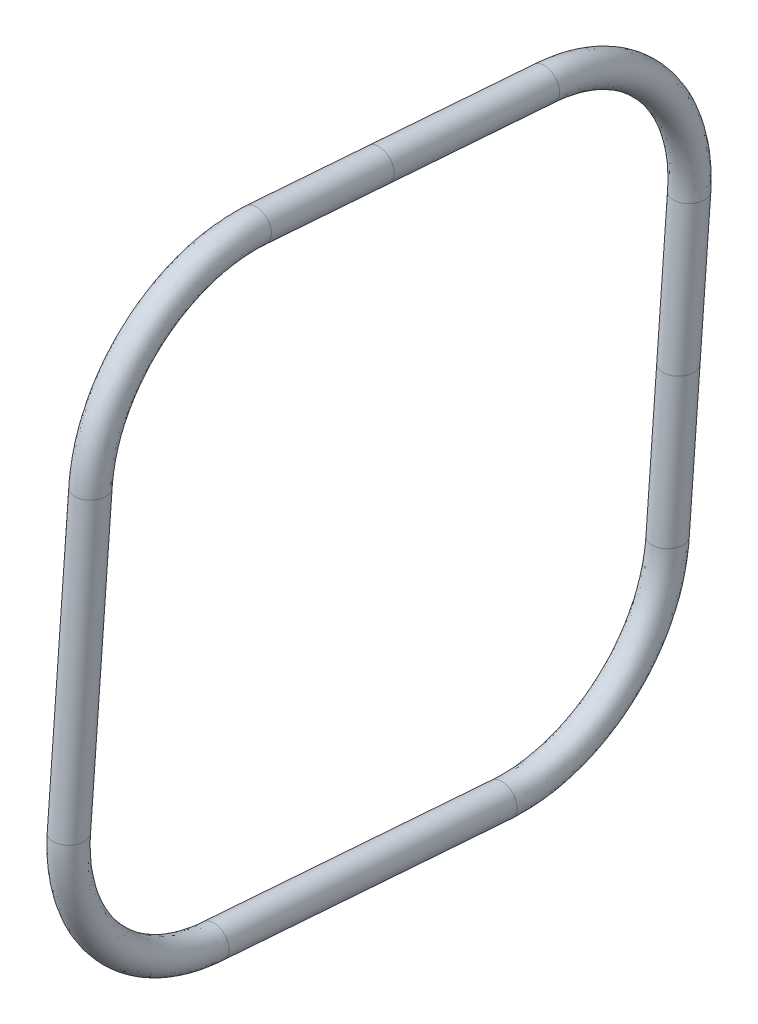
from build123d import *

# Parameters (mm, degrees)
SKETCH3_RX = 1.7653
SKETCH3_RY = 1.7399


with BuildPart() as part:
    # Sweep3: sweep along a path in Sketch4
    with BuildLine(Plane(origin=(0, 0, 0), x_dir=(0, 0, -1), z_dir=(1, 0, 0))) as sweep3_path:
        Line((-33.647493482, -14.019320477), (-31.184947753, 18.873107796))
        ThreePointArc((-31.184947753, 18.873107796), (-25.662009579, 29.815418452), (-14.019320477, 33.647493482))
        Line((-14.019320477, 33.647493482), (18.873107796, 31.184947753))
        ThreePointArc((18.873107796, 31.184947753), (29.815418452, 25.662009579), (33.647493482, 14.019320477))
        Line((33.647493482, 14.019320477), (32.416220618, -2.42689366))
        Line((32.416220618, -2.42689366), (31.184947754, -18.873107796))
        ThreePointArc((31.184947754, -18.873107796), (25.662009579, -29.815418452), (14.019320477, -33.647493482))
        Line((14.019320477, -33.647493482), (-18.873107796, -31.184947753))
        ThreePointArc((-18.873107796, -31.184947753), (-29.815418452, -25.662009579), (-33.647493482, -14.019320477))
    # Sketch3 → Sweep3 (sweep)
    with BuildSketch(Plane.XY):
        with Locations(Location((0, 34.363214002), (0, 0, -90))):
            Ellipse(SKETCH3_RX, SKETCH3_RY)
    sweep(path=sweep3_path.line)


solid = part.part
